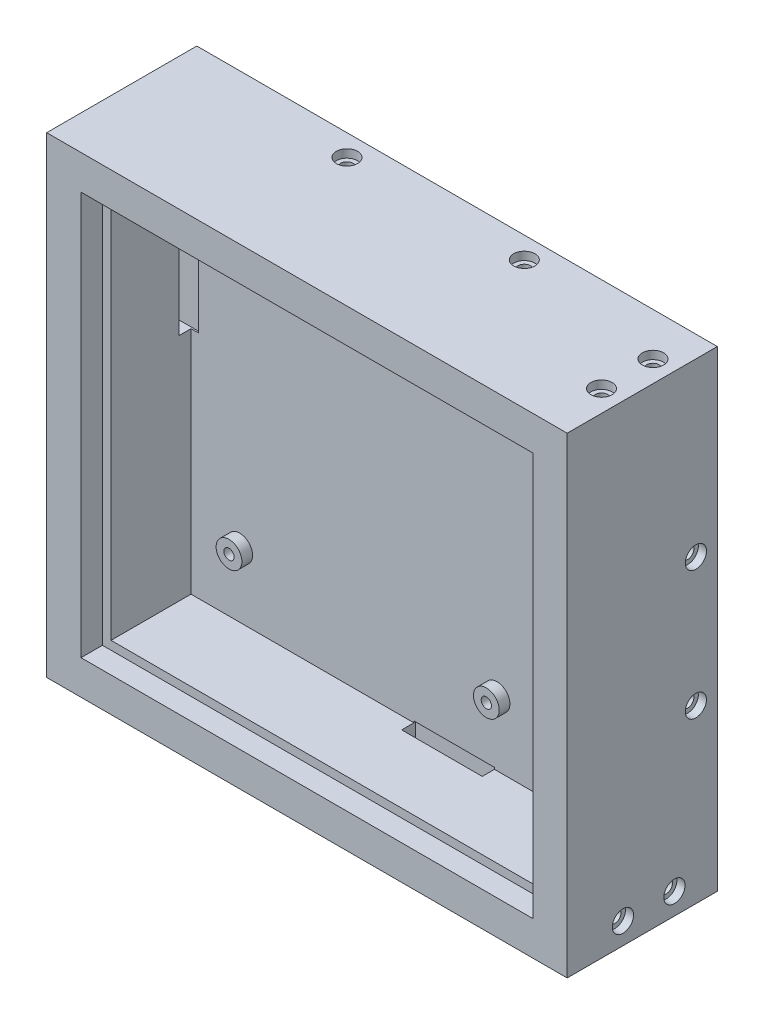
from build123d import *

# Parameters (mm, degrees)
SKETCH_1_W                     = 90
SKETCH_1_H                     = 90
EXTRUDE_1_DEPTH                = 1.6
SKETCH_4_W                     = 17.78
SKETCH_4_H                     = 8.5
SKETCH_4_W_2                   = 2.5
SKETCH_4_H_2                   = 17.78
SKETCH_4_W_3                   = 8.5
EXTRUDE_2_DEPTH                = 2.5
SKETCH_5_W                     = 0.64
SKETCH_5_H                     = 0.64
EXTRUDE_3_DEPTH                = 6.1
SKETCH_6_W                     = 3.48
SKETCH_6_H                     = 3.48
EXTRUDE_4_DEPTH                = 2
SKETCH_7_W                     = 2
SKETCH_7_H                     = 4
SKETCH_7_W_2                   = 4
SKETCH_7_H_2                   = 2
EXTRUDE_5_DEPTH                = 1.1
SKETCH_8_W                     = 7.4
SKETCH_8_H                     = 15.2
EXTRUDE_6_DEPTH                = 2.65
SKETCH_9_W                     = 0.64
SKETCH_9_H                     = 0.64
CUT_EXTRUDE_1_DEPTH            = 7.5
SKETCH_10_W                    = 0.64
SKETCH_10_H                    = 0.64
CUT_EXTRUDE_2_DEPTH            = 7.5
SKETCH_11_W                    = 0.64
SKETCH_11_H                    = 0.64
CUT_EXTRUDE_3_DEPTH            = 7.5
SKETCH_37_W                    = 18.78
SKETCH_37_H                    = 3.2
EXTRUDE_13_DEPTH               = 6
SKETCH_38_W                    = 3.2
SKETCH_38_H                    = 18.78
EXTRUDE_14_DEPTH               = 6
SKETCH_39_W                    = 18.78
SKETCH_39_H                    = 3.2
EXTRUDE_15_DEPTH               = 6
SKETCH_14_W                    = 101.35
SKETCH_14_H                    = 90
EXTRUDE_9_DEPTH                = 18.65
SKETCH_15_W                    = 121.35
SKETCH_15_H                    = 110
EXTRUDE_10_DEPTH               = 30
SKETCH_16_W                    = 1.5
SKETCH_16_H                    = 16.48
CUT_EXTRUDE_4_DEPTH            = 7
SKETCH_18_R                    = 3
SKETCH_18_R_2                  = 1.2
EXTRUDE_11_DEPTH               = 2.5
SKETCH_22_W                    = 121.35
SKETCH_22_H                    = 110
SKETCH_22_W_2                  = 105.35
SKETCH_22_H_2                  = 94
EXTRUDE_12_DEPTH               = 5
HOLE_WIZARD_M2_5_1_D           = 2.9
HOLE_WIZARD_M2_5_1_DEPTH       = 20
HOLE_WIZARD_M2_5_1_CBORE_D     = 4.95
HOLE_WIZARD_M2_5_1_CBORE_DEPTH = 1.9
HOLE_WIZARD_M2_5_1_TIP         = 0.871247898
HOLE_WIZARD_M2_5_2_D           = 2.9
HOLE_WIZARD_M2_5_2_DEPTH       = 20
HOLE_WIZARD_M2_5_2_CBORE_D     = 4.95
HOLE_WIZARD_M2_5_2_CBORE_DEPTH = 1.9
HOLE_WIZARD_M2_5_2_TIP         = 0.871247898
HOLE_WIZARD_M2_5_3_D           = 2.9
HOLE_WIZARD_M2_5_3_DEPTH       = 20
HOLE_WIZARD_M2_5_3_CBORE_D     = 4.95
HOLE_WIZARD_M2_5_3_CBORE_DEPTH = 1.9
HOLE_WIZARD_M2_5_3_TIP         = 0.871247898
HOLE_WIZARD_M2_5_4_D           = 2.9
HOLE_WIZARD_M2_5_4_DEPTH       = 20
HOLE_WIZARD_M2_5_4_CBORE_D     = 4.95
HOLE_WIZARD_M2_5_4_CBORE_DEPTH = 1.9
HOLE_WIZARD_M2_5_4_TIP         = 0.871247898
HOLE_WIZARD_M2_5_5_D           = 2.9
HOLE_WIZARD_M2_5_5_DEPTH       = 20
HOLE_WIZARD_M2_5_5_CBORE_D     = 4.95
HOLE_WIZARD_M2_5_5_CBORE_DEPTH = 1.9
HOLE_WIZARD_M2_5_5_TIP         = 0.871247898
HOLE_WIZARD_M2_5_6_D           = 2.9
HOLE_WIZARD_M2_5_6_DEPTH       = 20
HOLE_WIZARD_M2_5_6_CBORE_D     = 4.95
HOLE_WIZARD_M2_5_6_CBORE_DEPTH = 1.9
HOLE_WIZARD_M2_5_6_TIP         = 0.871247898
HOLE_WIZARD_M2_5_7_D           = 2.9
HOLE_WIZARD_M2_5_7_DEPTH       = 20
HOLE_WIZARD_M2_5_7_CBORE_D     = 4.95
HOLE_WIZARD_M2_5_7_CBORE_DEPTH = 1.9
HOLE_WIZARD_M2_5_7_TIP         = 0.871247898
HOLE_WIZARD_M2_5_8_D           = 2.9
HOLE_WIZARD_M2_5_8_DEPTH       = 20
HOLE_WIZARD_M2_5_8_CBORE_D     = 4.95
HOLE_WIZARD_M2_5_8_CBORE_DEPTH = 1.9
HOLE_WIZARD_M2_5_8_TIP         = 0.871247898


with BuildPart() as part:
    # ｽｹｯﾁ1 → ﾎﾞｽ - 押し出し1 (new body)
    with BuildSketch(Plane.XY):
        Rectangle(SKETCH_1_W, SKETCH_1_H)
    extrude(amount=EXTRUDE_1_DEPTH)

    # ｽｹｯﾁ4 → ﾎﾞｽ - 押し出し2 (add)
    with BuildSketch(Plane(origin=(0, 0, 0), x_dir=(-1, 0, 0), z_dir=(0, 0, -1))):
        with Locations((-15, -40.35)):
            Rectangle(SKETCH_4_W, SKETCH_4_H)
        with Locations((-37.6, 18)):
            Rectangle(SKETCH_4_W_2, SKETCH_4_H_2)
        with Locations((25, 40.35)):
            Rectangle(SKETCH_4_W, SKETCH_4_H)
        with Locations((40.35, 18)):
            Rectangle(SKETCH_4_W_3, SKETCH_4_H_2)
    extrude(amount=EXTRUDE_2_DEPTH)

    # ｽｹｯﾁ5 → ﾎﾞｽ - 押し出し3 (add)
    with BuildSketch(Plane(origin=(0, 0, -2.5), x_dir=(-1, 0, 0), z_dir=(0, 0, -1))):
        with Locations((-37.6, 18)):
            Rectangle(SKETCH_5_W, SKETCH_5_H)
        with Locations((-37.6, 15.46)):
            Rectangle(SKETCH_5_W, SKETCH_5_H)
        with Locations((-37.6, 12.92)):
            Rectangle(SKETCH_5_W, SKETCH_5_H)
        with Locations((-37.6, 10.38)):
            Rectangle(SKETCH_5_W, SKETCH_5_H)
        with Locations((-37.6, 20.54)):
            Rectangle(SKETCH_5_W, SKETCH_5_H)
        with Locations((-37.6, 23.08)):
            Rectangle(SKETCH_5_W, SKETCH_5_H)
        with Locations((-37.6, 25.62)):
            Rectangle(SKETCH_5_W, SKETCH_5_H)
    extrude(amount=EXTRUDE_3_DEPTH)

    # ｽｹｯﾁ6 → ﾎﾞｽ - 押し出し4 (add)
    with BuildSketch(Plane.XY.offset(1.6)):
        with Locations((-40, -35)):
            Rectangle(SKETCH_6_W, SKETCH_6_H)
        with Locations((-40, 35)):
            Rectangle(SKETCH_6_W, SKETCH_6_H)
        with Locations((30, -35)):
            Rectangle(SKETCH_6_W, SKETCH_6_H)
        with Locations((30, 35)):
            Rectangle(SKETCH_6_W, SKETCH_6_H)
    extrude(amount=EXTRUDE_4_DEPTH)

    # ｽｹｯﾁ7 → ﾎﾞｽ - 押し出し5 (add)
    with BuildSketch(Plane.XY.offset(1.6)):
        with Locations((-40, 0)):
            Rectangle(SKETCH_7_W, SKETCH_7_H)
        with Locations((30, 0)):
            Rectangle(SKETCH_7_W, SKETCH_7_H)
        with Locations((-5, 35)):
            Rectangle(SKETCH_7_W_2, SKETCH_7_H_2)
        with Locations((-5, -35)):
            Rectangle(SKETCH_7_W_2, SKETCH_7_H_2)
        with Locations((-5, 0)):
            Rectangle(SKETCH_7_W, SKETCH_7_H)
    extrude(amount=EXTRUDE_5_DEPTH)

    # ｽｹｯﾁ8 → ﾎﾞｽ - 押し出し6 (add)
    with BuildSketch(Plane.XY.offset(1.6)):
        with Locations((11, 0)):
            Rectangle(SKETCH_8_W, SKETCH_8_H)
    extrude(amount=EXTRUDE_6_DEPTH)

    # ｽｹｯﾁ9 → ｶｯﾄ - 押し出し1 (cut)
    with BuildSketch(Plane.XZ.offset(44.6)):
        with Locations((15, -1.25)):
            Rectangle(SKETCH_9_W, SKETCH_9_H)
        with Locations((12.46, -1.25)):
            Rectangle(SKETCH_9_W, SKETCH_9_H)
        with Locations((9.92, -1.25)):
            Rectangle(SKETCH_9_W, SKETCH_9_H)
        with Locations((7.38, -1.25)):
            Rectangle(SKETCH_9_W, SKETCH_9_H)
        with Locations((17.54, -1.25)):
            Rectangle(SKETCH_9_W, SKETCH_9_H)
        with Locations((20.08, -1.25)):
            Rectangle(SKETCH_9_W, SKETCH_9_H)
        with Locations((22.62, -1.25)):
            Rectangle(SKETCH_9_W, SKETCH_9_H)
    extrude(amount=-CUT_EXTRUDE_1_DEPTH, mode=Mode.SUBTRACT)

    # ｽｹｯﾁ10 → ｶｯﾄ - 押し出し2 (cut)
    with BuildSketch(Plane.ZY.offset(44.6)):
        with Locations((-1.25, 18)):
            Rectangle(SKETCH_10_W, SKETCH_10_H)
        with Locations((-1.25, 25.62)):
            Rectangle(SKETCH_10_W, SKETCH_10_H)
        with Locations((-1.25, 23.08)):
            Rectangle(SKETCH_10_W, SKETCH_10_H)
        with Locations((-1.25, 20.54)):
            Rectangle(SKETCH_10_W, SKETCH_10_H)
        with Locations((-1.25, 15.46)):
            Rectangle(SKETCH_10_W, SKETCH_10_H)
        with Locations((-1.25, 12.92)):
            Rectangle(SKETCH_10_W, SKETCH_10_H)
        with Locations((-1.25, 10.38)):
            Rectangle(SKETCH_10_W, SKETCH_10_H)
    extrude(amount=-CUT_EXTRUDE_2_DEPTH, mode=Mode.SUBTRACT)

    # ｽｹｯﾁ11 → ｶｯﾄ - 押し出し3 (cut)
    with BuildSketch(Plane(origin=(0, 44.6, 0), x_dir=(1, 0, 0), z_dir=(0, 1, 0))):
        with Locations((-25, 1.25)):
            Rectangle(SKETCH_11_W, SKETCH_11_H)
        with Locations((-32.62, 1.25)):
            Rectangle(SKETCH_11_W, SKETCH_11_H)
        with Locations((-30.08, 1.25)):
            Rectangle(SKETCH_11_W, SKETCH_11_H)
        with Locations((-27.54, 1.25)):
            Rectangle(SKETCH_11_W, SKETCH_11_H)
        with Locations((-22.46, 1.25)):
            Rectangle(SKETCH_11_W, SKETCH_11_H)
        with Locations((-19.92, 1.25)):
            Rectangle(SKETCH_11_W, SKETCH_11_H)
        with Locations((-17.38, 1.25)):
            Rectangle(SKETCH_11_W, SKETCH_11_H)
    extrude(amount=-CUT_EXTRUDE_3_DEPTH, mode=Mode.SUBTRACT)

    # ｽｹｯﾁ37 → ﾎﾞｽ - 押し出し13 (add)
    with BuildSketch(Plane(origin=(0, 44.6, 0), x_dir=(1, 0, 0), z_dir=(0, 1, 0))):
        with Locations((-25, 1.25)):
            Rectangle(SKETCH_37_W, SKETCH_37_H)
    extrude(amount=EXTRUDE_13_DEPTH)

    # ｽｹｯﾁ38 → ﾎﾞｽ - 押し出し14 (add)
    with BuildSketch(Plane.ZY.offset(44.6)):
        with Locations((-1.25, 18)):
            Rectangle(SKETCH_38_W, SKETCH_38_H)
    extrude(amount=EXTRUDE_14_DEPTH)

    # ｽｹｯﾁ39 → ﾎﾞｽ - 押し出し15 (add)
    with BuildSketch(Plane.XZ.offset(44.6)):
        with Locations((15, -1.25)):
            Rectangle(SKETCH_39_W, SKETCH_39_H)
    extrude(amount=EXTRUDE_15_DEPTH)


with BuildPart() as body_2:
    # ｽｹｯﾁ14 → ﾎﾞｽ - 押し出し9 (new body)
    with BuildSketch(Plane(origin=(0, 0, -2.5), x_dir=(-1, 0, 0), z_dir=(0, 0, -1))):
        with Locations((-4.325, 0)):
            Rectangle(SKETCH_14_W, SKETCH_14_H)
    extrude(amount=-EXTRUDE_9_DEPTH)


with BuildPart() as body_3:
    # ｽｹｯﾁ15 → ﾎﾞｽ - 押し出し10 (new body)
    with BuildSketch(Plane.XY.offset(16.15)):
        with Locations((4.325, 0)):
            Rectangle(SKETCH_15_W, SKETCH_15_H)
    extrude(amount=-EXTRUDE_10_DEPTH)

    # Combine 1: cut body 2, part
    add(body_2.part, mode=Mode.SUBTRACT)
    add(part.part, mode=Mode.SUBTRACT)

    # ｽｹｯﾁ16 → ｶｯﾄ - 押し出し4 (cut)
    with BuildSketch(Plane.XY.offset(-2.5)):
        with Locations((37.6, 18)):
            Rectangle(SKETCH_16_W, SKETCH_16_H)
    extrude(amount=-CUT_EXTRUDE_4_DEPTH, mode=Mode.SUBTRACT)

    # ｽｹｯﾁ18 → ﾎﾞｽ - 押し出し11 (add)
    # profile 1 of 4: a face of its own
    with BuildSketch(Plane.XY.offset(-2.5)):
        with Locations((-35, -30)):
            Circle(SKETCH_18_R)
        with Locations((-35, -30)):
            Circle(SKETCH_18_R_2, mode=Mode.SUBTRACT)
    # profile 2 of 4: a face of its own
    with BuildSketch(Plane.XY.offset(-2.5)):
        with Locations((-35, 30)):
            Circle(SKETCH_18_R)
        with Locations((-35, 30)):
            Circle(SKETCH_18_R_2, mode=Mode.SUBTRACT)
    # profile 3 of 4: a face of its own
    with BuildSketch(Plane.XY.offset(-2.5)):
        with Locations((25, 30)):
            Circle(SKETCH_18_R)
        with Locations((25, 30)):
            Circle(SKETCH_18_R_2, mode=Mode.SUBTRACT)
    # profile 4 of 4: a face of its own
    with BuildSketch(Plane.XY.offset(-2.5)):
        with Locations((25, -30)):
            Circle(SKETCH_18_R)
        with Locations((25, -30)):
            Circle(SKETCH_18_R_2, mode=Mode.SUBTRACT)
    extrude(amount=EXTRUDE_11_DEPTH)

    # ｽｹｯﾁ22 → ﾎﾞｽ - 押し出し12 (add)
    with BuildSketch(Plane.XY.offset(16.15)):
        with Locations((4.325, 0)):
            Rectangle(SKETCH_22_W, SKETCH_22_H)
        with Locations((4.325, 0)):
            Rectangle(SKETCH_22_W_2, SKETCH_22_H_2, mode=Mode.SUBTRACT)
    extrude(amount=EXTRUDE_12_DEPTH)

    # M2.5 丸平ねじ用座ぐり穴1
    with Locations(Plane(origin=(0, -55, 0), x_dir=(-1, 0, 0), z_dir=(0, -1, 0))):
        with Locations((51.35, -8.15), (51.35, 3.85)):
            CounterBoreHole(HOLE_WIZARD_M2_5_1_D / 2, HOLE_WIZARD_M2_5_1_CBORE_D / 2, HOLE_WIZARD_M2_5_1_CBORE_DEPTH, depth=HOLE_WIZARD_M2_5_1_DEPTH)
            with Locations((0, 0, -(HOLE_WIZARD_M2_5_1_DEPTH + HOLE_WIZARD_M2_5_1_TIP / 2))):  # 118° drill point
                Cone(0, HOLE_WIZARD_M2_5_1_D / 2, HOLE_WIZARD_M2_5_1_TIP, mode=Mode.SUBTRACT)

    # M2.5 丸平ねじ用座ぐり穴2
    with Locations(Plane.ZY.offset(56.35)):
        with Locations((8.15, 50), (-3.85, 50)):
            CounterBoreHole(HOLE_WIZARD_M2_5_2_D / 2, HOLE_WIZARD_M2_5_2_CBORE_D / 2, HOLE_WIZARD_M2_5_2_CBORE_DEPTH, depth=HOLE_WIZARD_M2_5_2_DEPTH)
            with Locations((0, 0, -(HOLE_WIZARD_M2_5_2_DEPTH + HOLE_WIZARD_M2_5_2_TIP / 2))):  # 118° drill point
                Cone(0, HOLE_WIZARD_M2_5_2_D / 2, HOLE_WIZARD_M2_5_2_TIP, mode=Mode.SUBTRACT)

    # M2.5 丸平ねじ用座ぐり穴3
    with Locations(Plane(origin=(0, 55, 0), x_dir=(1, 0, 0), z_dir=(0, 1, 0))):
        with Locations((60, -8.15), (60, 3.85)):
            CounterBoreHole(HOLE_WIZARD_M2_5_3_D / 2, HOLE_WIZARD_M2_5_3_CBORE_D / 2, HOLE_WIZARD_M2_5_3_CBORE_DEPTH, depth=HOLE_WIZARD_M2_5_3_DEPTH)
            with Locations((0, 0, -(HOLE_WIZARD_M2_5_3_DEPTH + HOLE_WIZARD_M2_5_3_TIP / 2))):  # 118° drill point
                Cone(0, HOLE_WIZARD_M2_5_3_D / 2, HOLE_WIZARD_M2_5_3_TIP, mode=Mode.SUBTRACT)

    # M2.5 丸平ねじ用座ぐり穴4
    with Locations(Plane(origin=(65, 0, 0), x_dir=(0, 0, -1), z_dir=(1, 0, 0))):
        with Locations((-8.15, -50), (3.85, -50)):
            CounterBoreHole(HOLE_WIZARD_M2_5_4_D / 2, HOLE_WIZARD_M2_5_4_CBORE_D / 2, HOLE_WIZARD_M2_5_4_CBORE_DEPTH, depth=HOLE_WIZARD_M2_5_4_DEPTH)
            with Locations((0, 0, -(HOLE_WIZARD_M2_5_4_DEPTH + HOLE_WIZARD_M2_5_4_TIP / 2))):  # 118° drill point
                Cone(0, HOLE_WIZARD_M2_5_4_D / 2, HOLE_WIZARD_M2_5_4_TIP, mode=Mode.SUBTRACT)

    # M2.5 丸平ねじ用座ぐり穴5
    with Locations(Plane(origin=(0, -55, 0), x_dir=(-1, 0, 0), z_dir=(0, -1, 0))):
        with Locations((-25, 8.85), (16.35, 8.85)):
            CounterBoreHole(HOLE_WIZARD_M2_5_5_D / 2, HOLE_WIZARD_M2_5_5_CBORE_D / 2, HOLE_WIZARD_M2_5_5_CBORE_DEPTH, depth=HOLE_WIZARD_M2_5_5_DEPTH)
            with Locations((0, 0, -(HOLE_WIZARD_M2_5_5_DEPTH + HOLE_WIZARD_M2_5_5_TIP / 2))):  # 118° drill point
                Cone(0, HOLE_WIZARD_M2_5_5_D / 2, HOLE_WIZARD_M2_5_5_TIP, mode=Mode.SUBTRACT)

    # M2.5 丸平ねじ用座ぐり穴6
    with Locations(Plane.ZY.offset(56.35)):
        with Locations((-8.85, 15), (-8.85, -15)):
            CounterBoreHole(HOLE_WIZARD_M2_5_6_D / 2, HOLE_WIZARD_M2_5_6_CBORE_D / 2, HOLE_WIZARD_M2_5_6_CBORE_DEPTH, depth=HOLE_WIZARD_M2_5_6_DEPTH)
            with Locations((0, 0, -(HOLE_WIZARD_M2_5_6_DEPTH + HOLE_WIZARD_M2_5_6_TIP / 2))):  # 118° drill point
                Cone(0, HOLE_WIZARD_M2_5_6_D / 2, HOLE_WIZARD_M2_5_6_TIP, mode=Mode.SUBTRACT)

    # M2.5 丸平ねじ用座ぐり穴7
    with Locations(Plane(origin=(0, 55, 0), x_dir=(1, 0, 0), z_dir=(0, 1, 0))):
        with Locations((-16.35, 8.85), (25, 8.85)):
            CounterBoreHole(HOLE_WIZARD_M2_5_7_D / 2, HOLE_WIZARD_M2_5_7_CBORE_D / 2, HOLE_WIZARD_M2_5_7_CBORE_DEPTH, depth=HOLE_WIZARD_M2_5_7_DEPTH)
            with Locations((0, 0, -(HOLE_WIZARD_M2_5_7_DEPTH + HOLE_WIZARD_M2_5_7_TIP / 2))):  # 118° drill point
                Cone(0, HOLE_WIZARD_M2_5_7_D / 2, HOLE_WIZARD_M2_5_7_TIP, mode=Mode.SUBTRACT)

    # M2.5 丸平ねじ用座ぐり穴8
    with Locations(Plane(origin=(65, 0, 0), x_dir=(0, 0, -1), z_dir=(1, 0, 0))):
        with Locations((8.85, 15), (8.85, -15)):
            CounterBoreHole(HOLE_WIZARD_M2_5_8_D / 2, HOLE_WIZARD_M2_5_8_CBORE_D / 2, HOLE_WIZARD_M2_5_8_CBORE_DEPTH, depth=HOLE_WIZARD_M2_5_8_DEPTH)
            with Locations((0, 0, -(HOLE_WIZARD_M2_5_8_DEPTH + HOLE_WIZARD_M2_5_8_TIP / 2))):  # 118° drill point
                Cone(0, HOLE_WIZARD_M2_5_8_D / 2, HOLE_WIZARD_M2_5_8_TIP, mode=Mode.SUBTRACT)


solid = body_3.part
